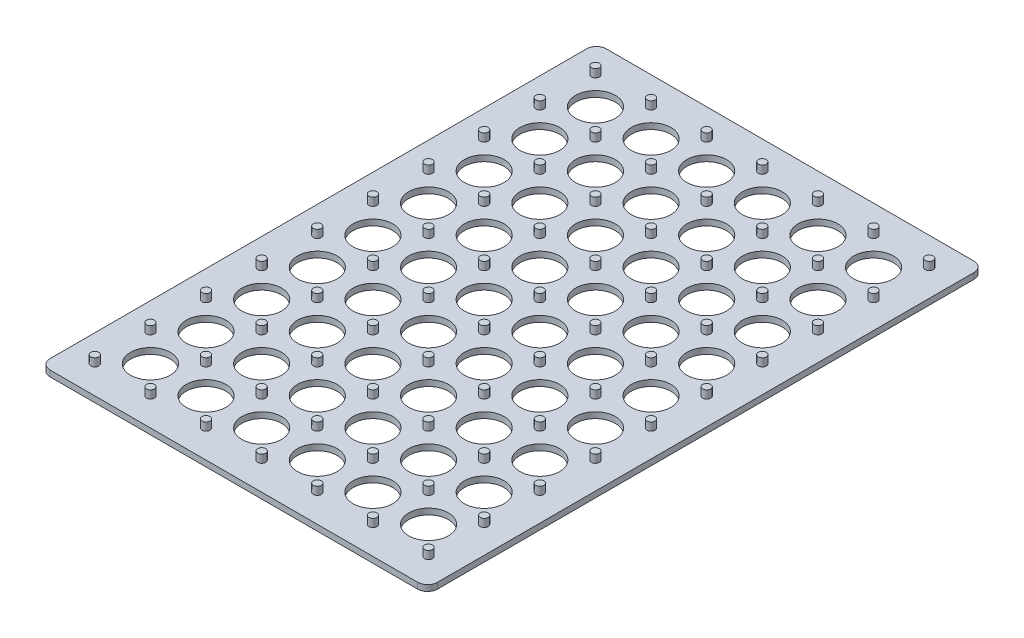
from build123d import *

# Parameters (mm, degrees)
SKETCH_1_W                        = 195
SKETCH_1_H                        = 280
EXTRUDE_1_DEPTH                   = 3
SKETCH_3_R                        = 2
EXTRUDE_2_DEPTH                   = 4
PATTERN_LINEAR_1_COUNT            = 4
PATTERN_LINEAR_1_PITCH            = 28
PATTERN_LINEAR_1_COL_COUNT        = 4
PATTERN_LINEAR_1_COL_PITCH        = 28
PATTERN_LINEAR_2_COUNT            = 10
PATTERN_LINEAR_2_PITCH            = 28
PATTERN_LINEAR_2_COPY_1_SKETCH_R  = 2
PATTERN_LINEAR_2_COPY_1_DEPTH     = 4
PATTERN_LINEAR_2_COPY_2_SKETCH_R  = 2
PATTERN_LINEAR_2_COPY_2_DEPTH     = 4
PATTERN_LINEAR_2_COPY_3_SKETCH_R  = 2
PATTERN_LINEAR_2_COPY_3_DEPTH     = 4
PATTERN_LINEAR_2_COPY_4_SKETCH_R  = 2
PATTERN_LINEAR_2_COPY_4_DEPTH     = 4
PATTERN_LINEAR_2_COPY_5_SKETCH_R  = 2
PATTERN_LINEAR_2_COPY_5_DEPTH     = 4
PATTERN_LINEAR_2_COPY_6_SKETCH_R  = 2
PATTERN_LINEAR_2_COPY_6_DEPTH     = 4
PATTERN_LINEAR_2_COPY_7_SKETCH_R  = 2
PATTERN_LINEAR_2_COPY_7_DEPTH     = 4
PATTERN_LINEAR_2_COPY_8_SKETCH_R  = 2
PATTERN_LINEAR_2_COPY_8_DEPTH     = 4
PATTERN_LINEAR_2_COPY_9_SKETCH_R  = 2
PATTERN_LINEAR_2_COPY_9_DEPTH     = 4
PATTERN_LINEAR_2_COPY_10_SKETCH_R = 2
PATTERN_LINEAR_2_COPY_10_DEPTH    = 4
PATTERN_LINEAR_2_COPY_11_SKETCH_R = 2
PATTERN_LINEAR_2_COPY_11_DEPTH    = 4
PATTERN_LINEAR_2_COPY_12_SKETCH_R = 2
PATTERN_LINEAR_2_COPY_12_DEPTH    = 4
PATTERN_LINEAR_2_COPY_13_SKETCH_R = 2
PATTERN_LINEAR_2_COPY_13_DEPTH    = 4
PATTERN_LINEAR_2_COPY_14_SKETCH_R = 2
PATTERN_LINEAR_2_COPY_14_DEPTH    = 4
PATTERN_LINEAR_2_COPY_15_SKETCH_R = 2
PATTERN_LINEAR_2_COPY_15_DEPTH    = 4
PATTERN_LINEAR_2_COPY_16_SKETCH_R = 2
PATTERN_LINEAR_2_COPY_16_DEPTH    = 4
PATTERN_LINEAR_2_COPY_17_SKETCH_R = 2
PATTERN_LINEAR_2_COPY_17_DEPTH    = 4
PATTERN_LINEAR_2_COPY_18_SKETCH_R = 2
PATTERN_LINEAR_2_COPY_18_DEPTH    = 4
PATTERN_LINEAR_2_COPY_19_SKETCH_R = 2
PATTERN_LINEAR_2_COPY_19_DEPTH    = 4
PATTERN_LINEAR_2_COPY_20_SKETCH_R = 2
PATTERN_LINEAR_2_COPY_20_DEPTH    = 4
PATTERN_LINEAR_2_COPY_21_SKETCH_R = 2
PATTERN_LINEAR_2_COPY_21_DEPTH    = 4
PATTERN_LINEAR_2_COPY_22_SKETCH_R = 2
PATTERN_LINEAR_2_COPY_22_DEPTH    = 4
PATTERN_LINEAR_2_COPY_23_SKETCH_R = 2
PATTERN_LINEAR_2_COPY_23_DEPTH    = 4
PATTERN_LINEAR_2_COPY_24_SKETCH_R = 2
PATTERN_LINEAR_2_COPY_24_DEPTH    = 4
PATTERN_LINEAR_2_COPY_25_SKETCH_R = 2
PATTERN_LINEAR_2_COPY_25_DEPTH    = 4
PATTERN_LINEAR_2_COPY_26_SKETCH_R = 2
PATTERN_LINEAR_2_COPY_26_DEPTH    = 4
PATTERN_LINEAR_2_COPY_27_SKETCH_R = 2
PATTERN_LINEAR_2_COPY_27_DEPTH    = 4
PATTERN_LINEAR_2_COPY_28_SKETCH_R = 2
PATTERN_LINEAR_2_COPY_28_DEPTH    = 4
PATTERN_LINEAR_2_COPY_29_SKETCH_R = 2
PATTERN_LINEAR_2_COPY_29_DEPTH    = 4
PATTERN_LINEAR_2_COPY_30_SKETCH_R = 2
PATTERN_LINEAR_2_COPY_30_DEPTH    = 4
PATTERN_LINEAR_2_COPY_31_SKETCH_R = 2
PATTERN_LINEAR_2_COPY_31_DEPTH    = 4
PATTERN_LINEAR_2_COPY_32_SKETCH_R = 2
PATTERN_LINEAR_2_COPY_32_DEPTH    = 4
PATTERN_LINEAR_2_COPY_33_SKETCH_R = 2
PATTERN_LINEAR_2_COPY_33_DEPTH    = 4
PATTERN_LINEAR_2_COPY_34_SKETCH_R = 2
PATTERN_LINEAR_2_COPY_34_DEPTH    = 4
PATTERN_LINEAR_2_COPY_35_SKETCH_R = 2
PATTERN_LINEAR_2_COPY_35_DEPTH    = 4
PATTERN_LINEAR_2_COPY_36_SKETCH_R = 2
PATTERN_LINEAR_2_COPY_36_DEPTH    = 4
PATTERN_LINEAR_2_COPY_37_SKETCH_R = 2
PATTERN_LINEAR_2_COPY_37_DEPTH    = 4
PATTERN_LINEAR_2_COPY_38_SKETCH_R = 2
PATTERN_LINEAR_2_COPY_38_DEPTH    = 4
PATTERN_LINEAR_2_COPY_39_SKETCH_R = 2
PATTERN_LINEAR_2_COPY_39_DEPTH    = 4
PATTERN_LINEAR_2_COPY_40_SKETCH_R = 2
PATTERN_LINEAR_2_COPY_40_DEPTH    = 4
PATTERN_LINEAR_2_COPY_41_SKETCH_R = 2
PATTERN_LINEAR_2_COPY_41_DEPTH    = 4
PATTERN_LINEAR_2_COPY_42_SKETCH_R = 2
PATTERN_LINEAR_2_COPY_42_DEPTH    = 4
PATTERN_LINEAR_2_COPY_43_SKETCH_R = 2
PATTERN_LINEAR_2_COPY_43_DEPTH    = 4
PATTERN_LINEAR_2_COPY_44_SKETCH_R = 2
PATTERN_LINEAR_2_COPY_44_DEPTH    = 4
PATTERN_LINEAR_2_COPY_45_SKETCH_R = 2
PATTERN_LINEAR_2_COPY_45_DEPTH    = 4
PATTERN_LINEAR_2_COPY_46_SKETCH_R = 2
PATTERN_LINEAR_2_COPY_46_DEPTH    = 4
PATTERN_LINEAR_2_COPY_47_SKETCH_R = 2
PATTERN_LINEAR_2_COPY_47_DEPTH    = 4
PATTERN_LINEAR_2_COPY_48_SKETCH_R = 2
PATTERN_LINEAR_2_COPY_48_DEPTH    = 4
PATTERN_LINEAR_2_COPY_49_SKETCH_R = 2
PATTERN_LINEAR_2_COPY_49_DEPTH    = 4
PATTERN_LINEAR_2_COPY_50_SKETCH_R = 2
PATTERN_LINEAR_2_COPY_50_DEPTH    = 4
PATTERN_LINEAR_2_COPY_51_SKETCH_R = 2
PATTERN_LINEAR_2_COPY_51_DEPTH    = 4
PATTERN_LINEAR_2_COPY_52_SKETCH_R = 2
PATTERN_LINEAR_2_COPY_52_DEPTH    = 4
PATTERN_LINEAR_2_COPY_53_SKETCH_R = 2
PATTERN_LINEAR_2_COPY_53_DEPTH    = 4
PATTERN_LINEAR_2_COPY_54_SKETCH_R = 2
PATTERN_LINEAR_2_COPY_54_DEPTH    = 4
SKETCH_4_R                        = 10
CUT_EXTRUDE_1_DEPTH               = 3
PATTERN_LINEAR_3_COUNT            = 3
PATTERN_LINEAR_3_PITCH            = 28
PATTERN_LINEAR_3_COL_COUNT        = 4
PATTERN_LINEAR_3_COL_PITCH        = 28
PATTERN_LINEAR_4_COUNT            = 9
PATTERN_LINEAR_4_PITCH            = 28
PATTERN_LINEAR_4_COPY_1_SKETCH_R  = 10
PATTERN_LINEAR_4_COPY_1_DEPTH     = 3
PATTERN_LINEAR_4_COPY_2_SKETCH_R  = 10
PATTERN_LINEAR_4_COPY_2_DEPTH     = 3
PATTERN_LINEAR_4_COPY_3_SKETCH_R  = 10
PATTERN_LINEAR_4_COPY_3_DEPTH     = 3
PATTERN_LINEAR_4_COPY_4_SKETCH_R  = 10
PATTERN_LINEAR_4_COPY_4_DEPTH     = 3
PATTERN_LINEAR_4_COPY_5_SKETCH_R  = 10
PATTERN_LINEAR_4_COPY_5_DEPTH     = 3
PATTERN_LINEAR_4_COPY_6_SKETCH_R  = 10
PATTERN_LINEAR_4_COPY_6_DEPTH     = 3
PATTERN_LINEAR_4_COPY_7_SKETCH_R  = 10
PATTERN_LINEAR_4_COPY_7_DEPTH     = 3
PATTERN_LINEAR_4_COPY_8_SKETCH_R  = 10
PATTERN_LINEAR_4_COPY_8_DEPTH     = 3
PATTERN_LINEAR_4_COPY_9_SKETCH_R  = 10
PATTERN_LINEAR_4_COPY_9_DEPTH     = 3
PATTERN_LINEAR_4_COPY_10_SKETCH_R = 10
PATTERN_LINEAR_4_COPY_10_DEPTH    = 3
PATTERN_LINEAR_4_COPY_11_SKETCH_R = 10
PATTERN_LINEAR_4_COPY_11_DEPTH    = 3
PATTERN_LINEAR_4_COPY_12_SKETCH_R = 10
PATTERN_LINEAR_4_COPY_12_DEPTH    = 3
PATTERN_LINEAR_4_COPY_13_SKETCH_R = 10
PATTERN_LINEAR_4_COPY_13_DEPTH    = 3
PATTERN_LINEAR_4_COPY_14_SKETCH_R = 10
PATTERN_LINEAR_4_COPY_14_DEPTH    = 3
PATTERN_LINEAR_4_COPY_15_SKETCH_R = 10
PATTERN_LINEAR_4_COPY_15_DEPTH    = 3
PATTERN_LINEAR_4_COPY_16_SKETCH_R = 10
PATTERN_LINEAR_4_COPY_16_DEPTH    = 3
PATTERN_LINEAR_4_COPY_17_SKETCH_R = 10
PATTERN_LINEAR_4_COPY_17_DEPTH    = 3
PATTERN_LINEAR_4_COPY_18_SKETCH_R = 10
PATTERN_LINEAR_4_COPY_18_DEPTH    = 3
PATTERN_LINEAR_4_COPY_19_SKETCH_R = 10
PATTERN_LINEAR_4_COPY_19_DEPTH    = 3
PATTERN_LINEAR_4_COPY_20_SKETCH_R = 10
PATTERN_LINEAR_4_COPY_20_DEPTH    = 3
PATTERN_LINEAR_4_COPY_21_SKETCH_R = 10
PATTERN_LINEAR_4_COPY_21_DEPTH    = 3
PATTERN_LINEAR_4_COPY_22_SKETCH_R = 10
PATTERN_LINEAR_4_COPY_22_DEPTH    = 3
PATTERN_LINEAR_4_COPY_23_SKETCH_R = 10
PATTERN_LINEAR_4_COPY_23_DEPTH    = 3
PATTERN_LINEAR_4_COPY_24_SKETCH_R = 10
PATTERN_LINEAR_4_COPY_24_DEPTH    = 3
PATTERN_LINEAR_4_COPY_25_SKETCH_R = 10
PATTERN_LINEAR_4_COPY_25_DEPTH    = 3
PATTERN_LINEAR_4_COPY_26_SKETCH_R = 10
PATTERN_LINEAR_4_COPY_26_DEPTH    = 3
PATTERN_LINEAR_4_COPY_27_SKETCH_R = 10
PATTERN_LINEAR_4_COPY_27_DEPTH    = 3
PATTERN_LINEAR_4_COPY_28_SKETCH_R = 10
PATTERN_LINEAR_4_COPY_28_DEPTH    = 3
PATTERN_LINEAR_4_COPY_29_SKETCH_R = 10
PATTERN_LINEAR_4_COPY_29_DEPTH    = 3
PATTERN_LINEAR_4_COPY_30_SKETCH_R = 10
PATTERN_LINEAR_4_COPY_30_DEPTH    = 3
PATTERN_LINEAR_4_COPY_31_SKETCH_R = 10
PATTERN_LINEAR_4_COPY_31_DEPTH    = 3
PATTERN_LINEAR_4_COPY_32_SKETCH_R = 10
PATTERN_LINEAR_4_COPY_32_DEPTH    = 3
PATTERN_LINEAR_4_COPY_33_SKETCH_R = 10
PATTERN_LINEAR_4_COPY_33_DEPTH    = 3
PATTERN_LINEAR_4_COPY_34_SKETCH_R = 10
PATTERN_LINEAR_4_COPY_34_DEPTH    = 3
PATTERN_LINEAR_4_COPY_35_SKETCH_R = 10
PATTERN_LINEAR_4_COPY_35_DEPTH    = 3
PATTERN_LINEAR_4_COPY_36_SKETCH_R = 10
PATTERN_LINEAR_4_COPY_36_DEPTH    = 3
PATTERN_LINEAR_4_COPY_37_SKETCH_R = 10
PATTERN_LINEAR_4_COPY_37_DEPTH    = 3
PATTERN_LINEAR_4_COPY_38_SKETCH_R = 10
PATTERN_LINEAR_4_COPY_38_DEPTH    = 3
PATTERN_LINEAR_4_COPY_39_SKETCH_R = 10
PATTERN_LINEAR_4_COPY_39_DEPTH    = 3
PATTERN_LINEAR_4_COPY_40_SKETCH_R = 10
PATTERN_LINEAR_4_COPY_40_DEPTH    = 3
FILLET_1_R                        = 5


with BuildPart() as part:
    # Эскиз1 → Бобышка-Вытянуть1 (new body)
    with BuildSketch(Plane(origin=(0, 0, 0), x_dir=(1, 0, 0), z_dir=(0, 1, 0))):
        with Locations((97.5, 140)):
            Rectangle(SKETCH_1_W, SKETCH_1_H)
    extrude(amount=EXTRUDE_1_DEPTH)

    # Эскиз3 → Бобышка-Вытянуть2 (add)
    with BuildSketch(Plane(origin=(0, 3, 0), x_dir=(1, 0, 0), z_dir=(0, 1, 0))):
        with Locations(Location((97.5, 266, 0), (0, 0, 90))):
            Circle(SKETCH_3_R)
    extrude_2 = extrude(amount=EXTRUDE_2_DEPTH)

    # Линейный массив1: Бобышка-Вытянуть2 ×4
    with Locations(*[(i * PATTERN_LINEAR_1_PITCH, 0, 0) for i in range(1, PATTERN_LINEAR_1_COUNT)]):
        add(extrude_2)

    # Линейный массив1 col: Бобышка-Вытянуть2 ×4
    with Locations(*[(-i * PATTERN_LINEAR_1_COL_PITCH, 0, 0) for i in range(1, PATTERN_LINEAR_1_COL_COUNT)]):
        add(extrude_2)

    # Линейный массив2: Бобышка-Вытянуть2 ×10
    with Locations(*[(0, 0, i * PATTERN_LINEAR_2_PITCH) for i in range(1, PATTERN_LINEAR_2_COUNT)]):
        add(extrude_2)

    # Линейный массив2 copy 1 sketch → Линейный массив2 copy 1 (add)
    with BuildSketch(Plane(origin=(28, 3, 28), x_dir=(1, 0, 0), z_dir=(0, 1, 0))):
        with Locations(Location((97.5, 266, 0), (0, 0, 90))):
            Circle(PATTERN_LINEAR_2_COPY_1_SKETCH_R)
    extrude(amount=PATTERN_LINEAR_2_COPY_1_DEPTH)

    # Линейный массив2 copy 2 sketch → Линейный массив2 copy 2 (add)
    with BuildSketch(Plane(origin=(28, 3, 56), x_dir=(1, 0, 0), z_dir=(0, 1, 0))):
        with Locations(Location((97.5, 266, 0), (0, 0, 90))):
            Circle(PATTERN_LINEAR_2_COPY_2_SKETCH_R)
    extrude(amount=PATTERN_LINEAR_2_COPY_2_DEPTH)

    # Линейный массив2 copy 3 sketch → Линейный массив2 copy 3 (add)
    with BuildSketch(Plane(origin=(28, 3, 84), x_dir=(1, 0, 0), z_dir=(0, 1, 0))):
        with Locations(Location((97.5, 266, 0), (0, 0, 90))):
            Circle(PATTERN_LINEAR_2_COPY_3_SKETCH_R)
    extrude(amount=PATTERN_LINEAR_2_COPY_3_DEPTH)

    # Линейный массив2 copy 4 sketch → Линейный массив2 copy 4 (add)
    with BuildSketch(Plane(origin=(28, 3, 112), x_dir=(1, 0, 0), z_dir=(0, 1, 0))):
        with Locations(Location((97.5, 266, 0), (0, 0, 90))):
            Circle(PATTERN_LINEAR_2_COPY_4_SKETCH_R)
    extrude(amount=PATTERN_LINEAR_2_COPY_4_DEPTH)

    # Линейный массив2 copy 5 sketch → Линейный массив2 copy 5 (add)
    with BuildSketch(Plane(origin=(28, 3, 140), x_dir=(1, 0, 0), z_dir=(0, 1, 0))):
        with Locations(Location((97.5, 266, 0), (0, 0, 90))):
            Circle(PATTERN_LINEAR_2_COPY_5_SKETCH_R)
    extrude(amount=PATTERN_LINEAR_2_COPY_5_DEPTH)

    # Линейный массив2 copy 6 sketch → Линейный массив2 copy 6 (add)
    with BuildSketch(Plane(origin=(28, 3, 168), x_dir=(1, 0, 0), z_dir=(0, 1, 0))):
        with Locations(Location((97.5, 266, 0), (0, 0, 90))):
            Circle(PATTERN_LINEAR_2_COPY_6_SKETCH_R)
    extrude(amount=PATTERN_LINEAR_2_COPY_6_DEPTH)

    # Линейный массив2 copy 7 sketch → Линейный массив2 copy 7 (add)
    with BuildSketch(Plane(origin=(28, 3, 196), x_dir=(1, 0, 0), z_dir=(0, 1, 0))):
        with Locations(Location((97.5, 266, 0), (0, 0, 90))):
            Circle(PATTERN_LINEAR_2_COPY_7_SKETCH_R)
    extrude(amount=PATTERN_LINEAR_2_COPY_7_DEPTH)

    # Линейный массив2 copy 8 sketch → Линейный массив2 copy 8 (add)
    with BuildSketch(Plane(origin=(28, 3, 224), x_dir=(1, 0, 0), z_dir=(0, 1, 0))):
        with Locations(Location((97.5, 266, 0), (0, 0, 90))):
            Circle(PATTERN_LINEAR_2_COPY_8_SKETCH_R)
    extrude(amount=PATTERN_LINEAR_2_COPY_8_DEPTH)

    # Линейный массив2 copy 9 sketch → Линейный массив2 copy 9 (add)
    with BuildSketch(Plane(origin=(28, 3, 252), x_dir=(1, 0, 0), z_dir=(0, 1, 0))):
        with Locations(Location((97.5, 266, 0), (0, 0, 90))):
            Circle(PATTERN_LINEAR_2_COPY_9_SKETCH_R)
    extrude(amount=PATTERN_LINEAR_2_COPY_9_DEPTH)

    # Линейный массив2 copy 10 sketch → Линейный массив2 copy 10 (add)
    with BuildSketch(Plane(origin=(56, 3, 28), x_dir=(1, 0, 0), z_dir=(0, 1, 0))):
        with Locations(Location((97.5, 266, 0), (0, 0, 90))):
            Circle(PATTERN_LINEAR_2_COPY_10_SKETCH_R)
    extrude(amount=PATTERN_LINEAR_2_COPY_10_DEPTH)

    # Линейный массив2 copy 11 sketch → Линейный массив2 copy 11 (add)
    with BuildSketch(Plane(origin=(56, 3, 56), x_dir=(1, 0, 0), z_dir=(0, 1, 0))):
        with Locations(Location((97.5, 266, 0), (0, 0, 90))):
            Circle(PATTERN_LINEAR_2_COPY_11_SKETCH_R)
    extrude(amount=PATTERN_LINEAR_2_COPY_11_DEPTH)

    # Линейный массив2 copy 12 sketch → Линейный массив2 copy 12 (add)
    with BuildSketch(Plane(origin=(56, 3, 84), x_dir=(1, 0, 0), z_dir=(0, 1, 0))):
        with Locations(Location((97.5, 266, 0), (0, 0, 90))):
            Circle(PATTERN_LINEAR_2_COPY_12_SKETCH_R)
    extrude(amount=PATTERN_LINEAR_2_COPY_12_DEPTH)

    # Линейный массив2 copy 13 sketch → Линейный массив2 copy 13 (add)
    with BuildSketch(Plane(origin=(56, 3, 112), x_dir=(1, 0, 0), z_dir=(0, 1, 0))):
        with Locations(Location((97.5, 266, 0), (0, 0, 90))):
            Circle(PATTERN_LINEAR_2_COPY_13_SKETCH_R)
    extrude(amount=PATTERN_LINEAR_2_COPY_13_DEPTH)

    # Линейный массив2 copy 14 sketch → Линейный массив2 copy 14 (add)
    with BuildSketch(Plane(origin=(56, 3, 140), x_dir=(1, 0, 0), z_dir=(0, 1, 0))):
        with Locations(Location((97.5, 266, 0), (0, 0, 90))):
            Circle(PATTERN_LINEAR_2_COPY_14_SKETCH_R)
    extrude(amount=PATTERN_LINEAR_2_COPY_14_DEPTH)

    # Линейный массив2 copy 15 sketch → Линейный массив2 copy 15 (add)
    with BuildSketch(Plane(origin=(56, 3, 168), x_dir=(1, 0, 0), z_dir=(0, 1, 0))):
        with Locations(Location((97.5, 266, 0), (0, 0, 90))):
            Circle(PATTERN_LINEAR_2_COPY_15_SKETCH_R)
    extrude(amount=PATTERN_LINEAR_2_COPY_15_DEPTH)

    # Линейный массив2 copy 16 sketch → Линейный массив2 copy 16 (add)
    with BuildSketch(Plane(origin=(56, 3, 196), x_dir=(1, 0, 0), z_dir=(0, 1, 0))):
        with Locations(Location((97.5, 266, 0), (0, 0, 90))):
            Circle(PATTERN_LINEAR_2_COPY_16_SKETCH_R)
    extrude(amount=PATTERN_LINEAR_2_COPY_16_DEPTH)

    # Линейный массив2 copy 17 sketch → Линейный массив2 copy 17 (add)
    with BuildSketch(Plane(origin=(56, 3, 224), x_dir=(1, 0, 0), z_dir=(0, 1, 0))):
        with Locations(Location((97.5, 266, 0), (0, 0, 90))):
            Circle(PATTERN_LINEAR_2_COPY_17_SKETCH_R)
    extrude(amount=PATTERN_LINEAR_2_COPY_17_DEPTH)

    # Линейный массив2 copy 18 sketch → Линейный массив2 copy 18 (add)
    with BuildSketch(Plane(origin=(56, 3, 252), x_dir=(1, 0, 0), z_dir=(0, 1, 0))):
        with Locations(Location((97.5, 266, 0), (0, 0, 90))):
            Circle(PATTERN_LINEAR_2_COPY_18_SKETCH_R)
    extrude(amount=PATTERN_LINEAR_2_COPY_18_DEPTH)

    # Линейный массив2 copy 19 sketch → Линейный массив2 copy 19 (add)
    with BuildSketch(Plane(origin=(84, 3, 28), x_dir=(1, 0, 0), z_dir=(0, 1, 0))):
        with Locations(Location((97.5, 266, 0), (0, 0, 90))):
            Circle(PATTERN_LINEAR_2_COPY_19_SKETCH_R)
    extrude(amount=PATTERN_LINEAR_2_COPY_19_DEPTH)

    # Линейный массив2 copy 20 sketch → Линейный массив2 copy 20 (add)
    with BuildSketch(Plane(origin=(84, 3, 56), x_dir=(1, 0, 0), z_dir=(0, 1, 0))):
        with Locations(Location((97.5, 266, 0), (0, 0, 90))):
            Circle(PATTERN_LINEAR_2_COPY_20_SKETCH_R)
    extrude(amount=PATTERN_LINEAR_2_COPY_20_DEPTH)

    # Линейный массив2 copy 21 sketch → Линейный массив2 copy 21 (add)
    with BuildSketch(Plane(origin=(84, 3, 84), x_dir=(1, 0, 0), z_dir=(0, 1, 0))):
        with Locations(Location((97.5, 266, 0), (0, 0, 90))):
            Circle(PATTERN_LINEAR_2_COPY_21_SKETCH_R)
    extrude(amount=PATTERN_LINEAR_2_COPY_21_DEPTH)

    # Линейный массив2 copy 22 sketch → Линейный массив2 copy 22 (add)
    with BuildSketch(Plane(origin=(84, 3, 112), x_dir=(1, 0, 0), z_dir=(0, 1, 0))):
        with Locations(Location((97.5, 266, 0), (0, 0, 90))):
            Circle(PATTERN_LINEAR_2_COPY_22_SKETCH_R)
    extrude(amount=PATTERN_LINEAR_2_COPY_22_DEPTH)

    # Линейный массив2 copy 23 sketch → Линейный массив2 copy 23 (add)
    with BuildSketch(Plane(origin=(84, 3, 140), x_dir=(1, 0, 0), z_dir=(0, 1, 0))):
        with Locations(Location((97.5, 266, 0), (0, 0, 90))):
            Circle(PATTERN_LINEAR_2_COPY_23_SKETCH_R)
    extrude(amount=PATTERN_LINEAR_2_COPY_23_DEPTH)

    # Линейный массив2 copy 24 sketch → Линейный массив2 copy 24 (add)
    with BuildSketch(Plane(origin=(84, 3, 168), x_dir=(1, 0, 0), z_dir=(0, 1, 0))):
        with Locations(Location((97.5, 266, 0), (0, 0, 90))):
            Circle(PATTERN_LINEAR_2_COPY_24_SKETCH_R)
    extrude(amount=PATTERN_LINEAR_2_COPY_24_DEPTH)

    # Линейный массив2 copy 25 sketch → Линейный массив2 copy 25 (add)
    with BuildSketch(Plane(origin=(84, 3, 196), x_dir=(1, 0, 0), z_dir=(0, 1, 0))):
        with Locations(Location((97.5, 266, 0), (0, 0, 90))):
            Circle(PATTERN_LINEAR_2_COPY_25_SKETCH_R)
    extrude(amount=PATTERN_LINEAR_2_COPY_25_DEPTH)

    # Линейный массив2 copy 26 sketch → Линейный массив2 copy 26 (add)
    with BuildSketch(Plane(origin=(84, 3, 224), x_dir=(1, 0, 0), z_dir=(0, 1, 0))):
        with Locations(Location((97.5, 266, 0), (0, 0, 90))):
            Circle(PATTERN_LINEAR_2_COPY_26_SKETCH_R)
    extrude(amount=PATTERN_LINEAR_2_COPY_26_DEPTH)

    # Линейный массив2 copy 27 sketch → Линейный массив2 copy 27 (add)
    with BuildSketch(Plane(origin=(84, 3, 252), x_dir=(1, 0, 0), z_dir=(0, 1, 0))):
        with Locations(Location((97.5, 266, 0), (0, 0, 90))):
            Circle(PATTERN_LINEAR_2_COPY_27_SKETCH_R)
    extrude(amount=PATTERN_LINEAR_2_COPY_27_DEPTH)

    # Линейный массив2 copy 28 sketch → Линейный массив2 copy 28 (add)
    with BuildSketch(Plane(origin=(-28, 3, 28), x_dir=(1, 0, 0), z_dir=(0, 1, 0))):
        with Locations(Location((97.5, 266, 0), (0, 0, 90))):
            Circle(PATTERN_LINEAR_2_COPY_28_SKETCH_R)
    extrude(amount=PATTERN_LINEAR_2_COPY_28_DEPTH)

    # Линейный массив2 copy 29 sketch → Линейный массив2 copy 29 (add)
    with BuildSketch(Plane(origin=(-28, 3, 56), x_dir=(1, 0, 0), z_dir=(0, 1, 0))):
        with Locations(Location((97.5, 266, 0), (0, 0, 90))):
            Circle(PATTERN_LINEAR_2_COPY_29_SKETCH_R)
    extrude(amount=PATTERN_LINEAR_2_COPY_29_DEPTH)

    # Линейный массив2 copy 30 sketch → Линейный массив2 copy 30 (add)
    with BuildSketch(Plane(origin=(-28, 3, 84), x_dir=(1, 0, 0), z_dir=(0, 1, 0))):
        with Locations(Location((97.5, 266, 0), (0, 0, 90))):
            Circle(PATTERN_LINEAR_2_COPY_30_SKETCH_R)
    extrude(amount=PATTERN_LINEAR_2_COPY_30_DEPTH)

    # Линейный массив2 copy 31 sketch → Линейный массив2 copy 31 (add)
    with BuildSketch(Plane(origin=(-28, 3, 112), x_dir=(1, 0, 0), z_dir=(0, 1, 0))):
        with Locations(Location((97.5, 266, 0), (0, 0, 90))):
            Circle(PATTERN_LINEAR_2_COPY_31_SKETCH_R)
    extrude(amount=PATTERN_LINEAR_2_COPY_31_DEPTH)

    # Линейный массив2 copy 32 sketch → Линейный массив2 copy 32 (add)
    with BuildSketch(Plane(origin=(-28, 3, 140), x_dir=(1, 0, 0), z_dir=(0, 1, 0))):
        with Locations(Location((97.5, 266, 0), (0, 0, 90))):
            Circle(PATTERN_LINEAR_2_COPY_32_SKETCH_R)
    extrude(amount=PATTERN_LINEAR_2_COPY_32_DEPTH)

    # Линейный массив2 copy 33 sketch → Линейный массив2 copy 33 (add)
    with BuildSketch(Plane(origin=(-28, 3, 168), x_dir=(1, 0, 0), z_dir=(0, 1, 0))):
        with Locations(Location((97.5, 266, 0), (0, 0, 90))):
            Circle(PATTERN_LINEAR_2_COPY_33_SKETCH_R)
    extrude(amount=PATTERN_LINEAR_2_COPY_33_DEPTH)

    # Линейный массив2 copy 34 sketch → Линейный массив2 copy 34 (add)
    with BuildSketch(Plane(origin=(-28, 3, 196), x_dir=(1, 0, 0), z_dir=(0, 1, 0))):
        with Locations(Location((97.5, 266, 0), (0, 0, 90))):
            Circle(PATTERN_LINEAR_2_COPY_34_SKETCH_R)
    extrude(amount=PATTERN_LINEAR_2_COPY_34_DEPTH)

    # Линейный массив2 copy 35 sketch → Линейный массив2 copy 35 (add)
    with BuildSketch(Plane(origin=(-28, 3, 224), x_dir=(1, 0, 0), z_dir=(0, 1, 0))):
        with Locations(Location((97.5, 266, 0), (0, 0, 90))):
            Circle(PATTERN_LINEAR_2_COPY_35_SKETCH_R)
    extrude(amount=PATTERN_LINEAR_2_COPY_35_DEPTH)

    # Линейный массив2 copy 36 sketch → Линейный массив2 copy 36 (add)
    with BuildSketch(Plane(origin=(-28, 3, 252), x_dir=(1, 0, 0), z_dir=(0, 1, 0))):
        with Locations(Location((97.5, 266, 0), (0, 0, 90))):
            Circle(PATTERN_LINEAR_2_COPY_36_SKETCH_R)
    extrude(amount=PATTERN_LINEAR_2_COPY_36_DEPTH)

    # Линейный массив2 copy 37 sketch → Линейный массив2 copy 37 (add)
    with BuildSketch(Plane(origin=(-56, 3, 28), x_dir=(1, 0, 0), z_dir=(0, 1, 0))):
        with Locations(Location((97.5, 266, 0), (0, 0, 90))):
            Circle(PATTERN_LINEAR_2_COPY_37_SKETCH_R)
    extrude(amount=PATTERN_LINEAR_2_COPY_37_DEPTH)

    # Линейный массив2 copy 38 sketch → Линейный массив2 copy 38 (add)
    with BuildSketch(Plane(origin=(-56, 3, 56), x_dir=(1, 0, 0), z_dir=(0, 1, 0))):
        with Locations(Location((97.5, 266, 0), (0, 0, 90))):
            Circle(PATTERN_LINEAR_2_COPY_38_SKETCH_R)
    extrude(amount=PATTERN_LINEAR_2_COPY_38_DEPTH)

    # Линейный массив2 copy 39 sketch → Линейный массив2 copy 39 (add)
    with BuildSketch(Plane(origin=(-56, 3, 84), x_dir=(1, 0, 0), z_dir=(0, 1, 0))):
        with Locations(Location((97.5, 266, 0), (0, 0, 90))):
            Circle(PATTERN_LINEAR_2_COPY_39_SKETCH_R)
    extrude(amount=PATTERN_LINEAR_2_COPY_39_DEPTH)

    # Линейный массив2 copy 40 sketch → Линейный массив2 copy 40 (add)
    with BuildSketch(Plane(origin=(-56, 3, 112), x_dir=(1, 0, 0), z_dir=(0, 1, 0))):
        with Locations(Location((97.5, 266, 0), (0, 0, 90))):
            Circle(PATTERN_LINEAR_2_COPY_40_SKETCH_R)
    extrude(amount=PATTERN_LINEAR_2_COPY_40_DEPTH)

    # Линейный массив2 copy 41 sketch → Линейный массив2 copy 41 (add)
    with BuildSketch(Plane(origin=(-56, 3, 140), x_dir=(1, 0, 0), z_dir=(0, 1, 0))):
        with Locations(Location((97.5, 266, 0), (0, 0, 90))):
            Circle(PATTERN_LINEAR_2_COPY_41_SKETCH_R)
    extrude(amount=PATTERN_LINEAR_2_COPY_41_DEPTH)

    # Линейный массив2 copy 42 sketch → Линейный массив2 copy 42 (add)
    with BuildSketch(Plane(origin=(-56, 3, 168), x_dir=(1, 0, 0), z_dir=(0, 1, 0))):
        with Locations(Location((97.5, 266, 0), (0, 0, 90))):
            Circle(PATTERN_LINEAR_2_COPY_42_SKETCH_R)
    extrude(amount=PATTERN_LINEAR_2_COPY_42_DEPTH)

    # Линейный массив2 copy 43 sketch → Линейный массив2 copy 43 (add)
    with BuildSketch(Plane(origin=(-56, 3, 196), x_dir=(1, 0, 0), z_dir=(0, 1, 0))):
        with Locations(Location((97.5, 266, 0), (0, 0, 90))):
            Circle(PATTERN_LINEAR_2_COPY_43_SKETCH_R)
    extrude(amount=PATTERN_LINEAR_2_COPY_43_DEPTH)

    # Линейный массив2 copy 44 sketch → Линейный массив2 copy 44 (add)
    with BuildSketch(Plane(origin=(-56, 3, 224), x_dir=(1, 0, 0), z_dir=(0, 1, 0))):
        with Locations(Location((97.5, 266, 0), (0, 0, 90))):
            Circle(PATTERN_LINEAR_2_COPY_44_SKETCH_R)
    extrude(amount=PATTERN_LINEAR_2_COPY_44_DEPTH)

    # Линейный массив2 copy 45 sketch → Линейный массив2 copy 45 (add)
    with BuildSketch(Plane(origin=(-56, 3, 252), x_dir=(1, 0, 0), z_dir=(0, 1, 0))):
        with Locations(Location((97.5, 266, 0), (0, 0, 90))):
            Circle(PATTERN_LINEAR_2_COPY_45_SKETCH_R)
    extrude(amount=PATTERN_LINEAR_2_COPY_45_DEPTH)

    # Линейный массив2 copy 46 sketch → Линейный массив2 copy 46 (add)
    with BuildSketch(Plane(origin=(-84, 3, 28), x_dir=(1, 0, 0), z_dir=(0, 1, 0))):
        with Locations(Location((97.5, 266, 0), (0, 0, 90))):
            Circle(PATTERN_LINEAR_2_COPY_46_SKETCH_R)
    extrude(amount=PATTERN_LINEAR_2_COPY_46_DEPTH)

    # Линейный массив2 copy 47 sketch → Линейный массив2 copy 47 (add)
    with BuildSketch(Plane(origin=(-84, 3, 56), x_dir=(1, 0, 0), z_dir=(0, 1, 0))):
        with Locations(Location((97.5, 266, 0), (0, 0, 90))):
            Circle(PATTERN_LINEAR_2_COPY_47_SKETCH_R)
    extrude(amount=PATTERN_LINEAR_2_COPY_47_DEPTH)

    # Линейный массив2 copy 48 sketch → Линейный массив2 copy 48 (add)
    with BuildSketch(Plane(origin=(-84, 3, 84), x_dir=(1, 0, 0), z_dir=(0, 1, 0))):
        with Locations(Location((97.5, 266, 0), (0, 0, 90))):
            Circle(PATTERN_LINEAR_2_COPY_48_SKETCH_R)
    extrude(amount=PATTERN_LINEAR_2_COPY_48_DEPTH)

    # Линейный массив2 copy 49 sketch → Линейный массив2 copy 49 (add)
    with BuildSketch(Plane(origin=(-84, 3, 112), x_dir=(1, 0, 0), z_dir=(0, 1, 0))):
        with Locations(Location((97.5, 266, 0), (0, 0, 90))):
            Circle(PATTERN_LINEAR_2_COPY_49_SKETCH_R)
    extrude(amount=PATTERN_LINEAR_2_COPY_49_DEPTH)

    # Линейный массив2 copy 50 sketch → Линейный массив2 copy 50 (add)
    with BuildSketch(Plane(origin=(-84, 3, 140), x_dir=(1, 0, 0), z_dir=(0, 1, 0))):
        with Locations(Location((97.5, 266, 0), (0, 0, 90))):
            Circle(PATTERN_LINEAR_2_COPY_50_SKETCH_R)
    extrude(amount=PATTERN_LINEAR_2_COPY_50_DEPTH)

    # Линейный массив2 copy 51 sketch → Линейный массив2 copy 51 (add)
    with BuildSketch(Plane(origin=(-84, 3, 168), x_dir=(1, 0, 0), z_dir=(0, 1, 0))):
        with Locations(Location((97.5, 266, 0), (0, 0, 90))):
            Circle(PATTERN_LINEAR_2_COPY_51_SKETCH_R)
    extrude(amount=PATTERN_LINEAR_2_COPY_51_DEPTH)

    # Линейный массив2 copy 52 sketch → Линейный массив2 copy 52 (add)
    with BuildSketch(Plane(origin=(-84, 3, 196), x_dir=(1, 0, 0), z_dir=(0, 1, 0))):
        with Locations(Location((97.5, 266, 0), (0, 0, 90))):
            Circle(PATTERN_LINEAR_2_COPY_52_SKETCH_R)
    extrude(amount=PATTERN_LINEAR_2_COPY_52_DEPTH)

    # Линейный массив2 copy 53 sketch → Линейный массив2 copy 53 (add)
    with BuildSketch(Plane(origin=(-84, 3, 224), x_dir=(1, 0, 0), z_dir=(0, 1, 0))):
        with Locations(Location((97.5, 266, 0), (0, 0, 90))):
            Circle(PATTERN_LINEAR_2_COPY_53_SKETCH_R)
    extrude(amount=PATTERN_LINEAR_2_COPY_53_DEPTH)

    # Линейный массив2 copy 54 sketch → Линейный массив2 copy 54 (add)
    with BuildSketch(Plane(origin=(-84, 3, 252), x_dir=(1, 0, 0), z_dir=(0, 1, 0))):
        with Locations(Location((97.5, 266, 0), (0, 0, 90))):
            Circle(PATTERN_LINEAR_2_COPY_54_SKETCH_R)
    extrude(amount=PATTERN_LINEAR_2_COPY_54_DEPTH)

    # Эскиз4 → Вырез-Вытянуть1 (cut)
    with BuildSketch(Plane(origin=(0, 3, 0), x_dir=(1, 0, 0), z_dir=(0, 1, 0))):
        with Locations(Location((111.5, 252, 0), (0, 0, 270))):
            Circle(SKETCH_4_R)
    cut_extrude_1 = extrude(amount=-CUT_EXTRUDE_1_DEPTH, mode=Mode.SUBTRACT)

    # Линейный массив3: Вырез-Вытянуть1 ×3
    with Locations(*[(i * PATTERN_LINEAR_3_PITCH, 0, 0) for i in range(1, PATTERN_LINEAR_3_COUNT)]):
        add(cut_extrude_1, mode=Mode.SUBTRACT)

    # Линейный массив3 col: Вырез-Вытянуть1 ×4
    with Locations(*[(-i * PATTERN_LINEAR_3_COL_PITCH, 0, 0) for i in range(1, PATTERN_LINEAR_3_COL_COUNT)]):
        add(cut_extrude_1, mode=Mode.SUBTRACT)

    # Линейный массив4: Вырез-Вытянуть1 ×9
    with Locations(*[(0, 0, i * PATTERN_LINEAR_4_PITCH) for i in range(1, PATTERN_LINEAR_4_COUNT)]):
        add(cut_extrude_1, mode=Mode.SUBTRACT)

    # Линейный массив4 copy 1 sketch → Линейный массив4 copy 1 (cut)
    with BuildSketch(Plane(origin=(28, 3, 28), x_dir=(1, 0, 0), z_dir=(0, 1, 0))):
        with Locations(Location((111.5, 252, 0), (0, 0, 270))):
            Circle(PATTERN_LINEAR_4_COPY_1_SKETCH_R)
    extrude(amount=-PATTERN_LINEAR_4_COPY_1_DEPTH, mode=Mode.SUBTRACT)

    # Линейный массив4 copy 2 sketch → Линейный массив4 copy 2 (cut)
    with BuildSketch(Plane(origin=(28, 3, 56), x_dir=(1, 0, 0), z_dir=(0, 1, 0))):
        with Locations(Location((111.5, 252, 0), (0, 0, 270))):
            Circle(PATTERN_LINEAR_4_COPY_2_SKETCH_R)
    extrude(amount=-PATTERN_LINEAR_4_COPY_2_DEPTH, mode=Mode.SUBTRACT)

    # Линейный массив4 copy 3 sketch → Линейный массив4 copy 3 (cut)
    with BuildSketch(Plane(origin=(28, 3, 84), x_dir=(1, 0, 0), z_dir=(0, 1, 0))):
        with Locations(Location((111.5, 252, 0), (0, 0, 270))):
            Circle(PATTERN_LINEAR_4_COPY_3_SKETCH_R)
    extrude(amount=-PATTERN_LINEAR_4_COPY_3_DEPTH, mode=Mode.SUBTRACT)

    # Линейный массив4 copy 4 sketch → Линейный массив4 copy 4 (cut)
    with BuildSketch(Plane(origin=(28, 3, 112), x_dir=(1, 0, 0), z_dir=(0, 1, 0))):
        with Locations(Location((111.5, 252, 0), (0, 0, 270))):
            Circle(PATTERN_LINEAR_4_COPY_4_SKETCH_R)
    extrude(amount=-PATTERN_LINEAR_4_COPY_4_DEPTH, mode=Mode.SUBTRACT)

    # Линейный массив4 copy 5 sketch → Линейный массив4 copy 5 (cut)
    with BuildSketch(Plane(origin=(28, 3, 140), x_dir=(1, 0, 0), z_dir=(0, 1, 0))):
        with Locations(Location((111.5, 252, 0), (0, 0, 270))):
            Circle(PATTERN_LINEAR_4_COPY_5_SKETCH_R)
    extrude(amount=-PATTERN_LINEAR_4_COPY_5_DEPTH, mode=Mode.SUBTRACT)

    # Линейный массив4 copy 6 sketch → Линейный массив4 copy 6 (cut)
    with BuildSketch(Plane(origin=(28, 3, 168), x_dir=(1, 0, 0), z_dir=(0, 1, 0))):
        with Locations(Location((111.5, 252, 0), (0, 0, 270))):
            Circle(PATTERN_LINEAR_4_COPY_6_SKETCH_R)
    extrude(amount=-PATTERN_LINEAR_4_COPY_6_DEPTH, mode=Mode.SUBTRACT)

    # Линейный массив4 copy 7 sketch → Линейный массив4 copy 7 (cut)
    with BuildSketch(Plane(origin=(28, 3, 196), x_dir=(1, 0, 0), z_dir=(0, 1, 0))):
        with Locations(Location((111.5, 252, 0), (0, 0, 270))):
            Circle(PATTERN_LINEAR_4_COPY_7_SKETCH_R)
    extrude(amount=-PATTERN_LINEAR_4_COPY_7_DEPTH, mode=Mode.SUBTRACT)

    # Линейный массив4 copy 8 sketch → Линейный массив4 copy 8 (cut)
    with BuildSketch(Plane(origin=(28, 3, 224), x_dir=(1, 0, 0), z_dir=(0, 1, 0))):
        with Locations(Location((111.5, 252, 0), (0, 0, 270))):
            Circle(PATTERN_LINEAR_4_COPY_8_SKETCH_R)
    extrude(amount=-PATTERN_LINEAR_4_COPY_8_DEPTH, mode=Mode.SUBTRACT)

    # Линейный массив4 copy 9 sketch → Линейный массив4 copy 9 (cut)
    with BuildSketch(Plane(origin=(56, 3, 28), x_dir=(1, 0, 0), z_dir=(0, 1, 0))):
        with Locations(Location((111.5, 252, 0), (0, 0, 270))):
            Circle(PATTERN_LINEAR_4_COPY_9_SKETCH_R)
    extrude(amount=-PATTERN_LINEAR_4_COPY_9_DEPTH, mode=Mode.SUBTRACT)

    # Линейный массив4 copy 10 sketch → Линейный массив4 copy 10 (cut)
    with BuildSketch(Plane(origin=(56, 3, 56), x_dir=(1, 0, 0), z_dir=(0, 1, 0))):
        with Locations(Location((111.5, 252, 0), (0, 0, 270))):
            Circle(PATTERN_LINEAR_4_COPY_10_SKETCH_R)
    extrude(amount=-PATTERN_LINEAR_4_COPY_10_DEPTH, mode=Mode.SUBTRACT)

    # Линейный массив4 copy 11 sketch → Линейный массив4 copy 11 (cut)
    with BuildSketch(Plane(origin=(56, 3, 84), x_dir=(1, 0, 0), z_dir=(0, 1, 0))):
        with Locations(Location((111.5, 252, 0), (0, 0, 270))):
            Circle(PATTERN_LINEAR_4_COPY_11_SKETCH_R)
    extrude(amount=-PATTERN_LINEAR_4_COPY_11_DEPTH, mode=Mode.SUBTRACT)

    # Линейный массив4 copy 12 sketch → Линейный массив4 copy 12 (cut)
    with BuildSketch(Plane(origin=(56, 3, 112), x_dir=(1, 0, 0), z_dir=(0, 1, 0))):
        with Locations(Location((111.5, 252, 0), (0, 0, 270))):
            Circle(PATTERN_LINEAR_4_COPY_12_SKETCH_R)
    extrude(amount=-PATTERN_LINEAR_4_COPY_12_DEPTH, mode=Mode.SUBTRACT)

    # Линейный массив4 copy 13 sketch → Линейный массив4 copy 13 (cut)
    with BuildSketch(Plane(origin=(56, 3, 140), x_dir=(1, 0, 0), z_dir=(0, 1, 0))):
        with Locations(Location((111.5, 252, 0), (0, 0, 270))):
            Circle(PATTERN_LINEAR_4_COPY_13_SKETCH_R)
    extrude(amount=-PATTERN_LINEAR_4_COPY_13_DEPTH, mode=Mode.SUBTRACT)

    # Линейный массив4 copy 14 sketch → Линейный массив4 copy 14 (cut)
    with BuildSketch(Plane(origin=(56, 3, 168), x_dir=(1, 0, 0), z_dir=(0, 1, 0))):
        with Locations(Location((111.5, 252, 0), (0, 0, 270))):
            Circle(PATTERN_LINEAR_4_COPY_14_SKETCH_R)
    extrude(amount=-PATTERN_LINEAR_4_COPY_14_DEPTH, mode=Mode.SUBTRACT)

    # Линейный массив4 copy 15 sketch → Линейный массив4 copy 15 (cut)
    with BuildSketch(Plane(origin=(56, 3, 196), x_dir=(1, 0, 0), z_dir=(0, 1, 0))):
        with Locations(Location((111.5, 252, 0), (0, 0, 270))):
            Circle(PATTERN_LINEAR_4_COPY_15_SKETCH_R)
    extrude(amount=-PATTERN_LINEAR_4_COPY_15_DEPTH, mode=Mode.SUBTRACT)

    # Линейный массив4 copy 16 sketch → Линейный массив4 copy 16 (cut)
    with BuildSketch(Plane(origin=(56, 3, 224), x_dir=(1, 0, 0), z_dir=(0, 1, 0))):
        with Locations(Location((111.5, 252, 0), (0, 0, 270))):
            Circle(PATTERN_LINEAR_4_COPY_16_SKETCH_R)
    extrude(amount=-PATTERN_LINEAR_4_COPY_16_DEPTH, mode=Mode.SUBTRACT)

    # Линейный массив4 copy 17 sketch → Линейный массив4 copy 17 (cut)
    with BuildSketch(Plane(origin=(-28, 3, 28), x_dir=(1, 0, 0), z_dir=(0, 1, 0))):
        with Locations(Location((111.5, 252, 0), (0, 0, 270))):
            Circle(PATTERN_LINEAR_4_COPY_17_SKETCH_R)
    extrude(amount=-PATTERN_LINEAR_4_COPY_17_DEPTH, mode=Mode.SUBTRACT)

    # Линейный массив4 copy 18 sketch → Линейный массив4 copy 18 (cut)
    with BuildSketch(Plane(origin=(-28, 3, 56), x_dir=(1, 0, 0), z_dir=(0, 1, 0))):
        with Locations(Location((111.5, 252, 0), (0, 0, 270))):
            Circle(PATTERN_LINEAR_4_COPY_18_SKETCH_R)
    extrude(amount=-PATTERN_LINEAR_4_COPY_18_DEPTH, mode=Mode.SUBTRACT)

    # Линейный массив4 copy 19 sketch → Линейный массив4 copy 19 (cut)
    with BuildSketch(Plane(origin=(-28, 3, 84), x_dir=(1, 0, 0), z_dir=(0, 1, 0))):
        with Locations(Location((111.5, 252, 0), (0, 0, 270))):
            Circle(PATTERN_LINEAR_4_COPY_19_SKETCH_R)
    extrude(amount=-PATTERN_LINEAR_4_COPY_19_DEPTH, mode=Mode.SUBTRACT)

    # Линейный массив4 copy 20 sketch → Линейный массив4 copy 20 (cut)
    with BuildSketch(Plane(origin=(-28, 3, 112), x_dir=(1, 0, 0), z_dir=(0, 1, 0))):
        with Locations(Location((111.5, 252, 0), (0, 0, 270))):
            Circle(PATTERN_LINEAR_4_COPY_20_SKETCH_R)
    extrude(amount=-PATTERN_LINEAR_4_COPY_20_DEPTH, mode=Mode.SUBTRACT)

    # Линейный массив4 copy 21 sketch → Линейный массив4 copy 21 (cut)
    with BuildSketch(Plane(origin=(-28, 3, 140), x_dir=(1, 0, 0), z_dir=(0, 1, 0))):
        with Locations(Location((111.5, 252, 0), (0, 0, 270))):
            Circle(PATTERN_LINEAR_4_COPY_21_SKETCH_R)
    extrude(amount=-PATTERN_LINEAR_4_COPY_21_DEPTH, mode=Mode.SUBTRACT)

    # Линейный массив4 copy 22 sketch → Линейный массив4 copy 22 (cut)
    with BuildSketch(Plane(origin=(-28, 3, 168), x_dir=(1, 0, 0), z_dir=(0, 1, 0))):
        with Locations(Location((111.5, 252, 0), (0, 0, 270))):
            Circle(PATTERN_LINEAR_4_COPY_22_SKETCH_R)
    extrude(amount=-PATTERN_LINEAR_4_COPY_22_DEPTH, mode=Mode.SUBTRACT)

    # Линейный массив4 copy 23 sketch → Линейный массив4 copy 23 (cut)
    with BuildSketch(Plane(origin=(-28, 3, 196), x_dir=(1, 0, 0), z_dir=(0, 1, 0))):
        with Locations(Location((111.5, 252, 0), (0, 0, 270))):
            Circle(PATTERN_LINEAR_4_COPY_23_SKETCH_R)
    extrude(amount=-PATTERN_LINEAR_4_COPY_23_DEPTH, mode=Mode.SUBTRACT)

    # Линейный массив4 copy 24 sketch → Линейный массив4 copy 24 (cut)
    with BuildSketch(Plane(origin=(-28, 3, 224), x_dir=(1, 0, 0), z_dir=(0, 1, 0))):
        with Locations(Location((111.5, 252, 0), (0, 0, 270))):
            Circle(PATTERN_LINEAR_4_COPY_24_SKETCH_R)
    extrude(amount=-PATTERN_LINEAR_4_COPY_24_DEPTH, mode=Mode.SUBTRACT)

    # Линейный массив4 copy 25 sketch → Линейный массив4 copy 25 (cut)
    with BuildSketch(Plane(origin=(-56, 3, 28), x_dir=(1, 0, 0), z_dir=(0, 1, 0))):
        with Locations(Location((111.5, 252, 0), (0, 0, 270))):
            Circle(PATTERN_LINEAR_4_COPY_25_SKETCH_R)
    extrude(amount=-PATTERN_LINEAR_4_COPY_25_DEPTH, mode=Mode.SUBTRACT)

    # Линейный массив4 copy 26 sketch → Линейный массив4 copy 26 (cut)
    with BuildSketch(Plane(origin=(-56, 3, 56), x_dir=(1, 0, 0), z_dir=(0, 1, 0))):
        with Locations(Location((111.5, 252, 0), (0, 0, 270))):
            Circle(PATTERN_LINEAR_4_COPY_26_SKETCH_R)
    extrude(amount=-PATTERN_LINEAR_4_COPY_26_DEPTH, mode=Mode.SUBTRACT)

    # Линейный массив4 copy 27 sketch → Линейный массив4 copy 27 (cut)
    with BuildSketch(Plane(origin=(-56, 3, 84), x_dir=(1, 0, 0), z_dir=(0, 1, 0))):
        with Locations(Location((111.5, 252, 0), (0, 0, 270))):
            Circle(PATTERN_LINEAR_4_COPY_27_SKETCH_R)
    extrude(amount=-PATTERN_LINEAR_4_COPY_27_DEPTH, mode=Mode.SUBTRACT)

    # Линейный массив4 copy 28 sketch → Линейный массив4 copy 28 (cut)
    with BuildSketch(Plane(origin=(-56, 3, 112), x_dir=(1, 0, 0), z_dir=(0, 1, 0))):
        with Locations(Location((111.5, 252, 0), (0, 0, 270))):
            Circle(PATTERN_LINEAR_4_COPY_28_SKETCH_R)
    extrude(amount=-PATTERN_LINEAR_4_COPY_28_DEPTH, mode=Mode.SUBTRACT)

    # Линейный массив4 copy 29 sketch → Линейный массив4 copy 29 (cut)
    with BuildSketch(Plane(origin=(-56, 3, 140), x_dir=(1, 0, 0), z_dir=(0, 1, 0))):
        with Locations(Location((111.5, 252, 0), (0, 0, 270))):
            Circle(PATTERN_LINEAR_4_COPY_29_SKETCH_R)
    extrude(amount=-PATTERN_LINEAR_4_COPY_29_DEPTH, mode=Mode.SUBTRACT)

    # Линейный массив4 copy 30 sketch → Линейный массив4 copy 30 (cut)
    with BuildSketch(Plane(origin=(-56, 3, 168), x_dir=(1, 0, 0), z_dir=(0, 1, 0))):
        with Locations(Location((111.5, 252, 0), (0, 0, 270))):
            Circle(PATTERN_LINEAR_4_COPY_30_SKETCH_R)
    extrude(amount=-PATTERN_LINEAR_4_COPY_30_DEPTH, mode=Mode.SUBTRACT)

    # Линейный массив4 copy 31 sketch → Линейный массив4 copy 31 (cut)
    with BuildSketch(Plane(origin=(-56, 3, 196), x_dir=(1, 0, 0), z_dir=(0, 1, 0))):
        with Locations(Location((111.5, 252, 0), (0, 0, 270))):
            Circle(PATTERN_LINEAR_4_COPY_31_SKETCH_R)
    extrude(amount=-PATTERN_LINEAR_4_COPY_31_DEPTH, mode=Mode.SUBTRACT)

    # Линейный массив4 copy 32 sketch → Линейный массив4 copy 32 (cut)
    with BuildSketch(Plane(origin=(-56, 3, 224), x_dir=(1, 0, 0), z_dir=(0, 1, 0))):
        with Locations(Location((111.5, 252, 0), (0, 0, 270))):
            Circle(PATTERN_LINEAR_4_COPY_32_SKETCH_R)
    extrude(amount=-PATTERN_LINEAR_4_COPY_32_DEPTH, mode=Mode.SUBTRACT)

    # Линейный массив4 copy 33 sketch → Линейный массив4 copy 33 (cut)
    with BuildSketch(Plane(origin=(-84, 3, 28), x_dir=(1, 0, 0), z_dir=(0, 1, 0))):
        with Locations(Location((111.5, 252, 0), (0, 0, 270))):
            Circle(PATTERN_LINEAR_4_COPY_33_SKETCH_R)
    extrude(amount=-PATTERN_LINEAR_4_COPY_33_DEPTH, mode=Mode.SUBTRACT)

    # Линейный массив4 copy 34 sketch → Линейный массив4 copy 34 (cut)
    with BuildSketch(Plane(origin=(-84, 3, 56), x_dir=(1, 0, 0), z_dir=(0, 1, 0))):
        with Locations(Location((111.5, 252, 0), (0, 0, 270))):
            Circle(PATTERN_LINEAR_4_COPY_34_SKETCH_R)
    extrude(amount=-PATTERN_LINEAR_4_COPY_34_DEPTH, mode=Mode.SUBTRACT)

    # Линейный массив4 copy 35 sketch → Линейный массив4 copy 35 (cut)
    with BuildSketch(Plane(origin=(-84, 3, 84), x_dir=(1, 0, 0), z_dir=(0, 1, 0))):
        with Locations(Location((111.5, 252, 0), (0, 0, 270))):
            Circle(PATTERN_LINEAR_4_COPY_35_SKETCH_R)
    extrude(amount=-PATTERN_LINEAR_4_COPY_35_DEPTH, mode=Mode.SUBTRACT)

    # Линейный массив4 copy 36 sketch → Линейный массив4 copy 36 (cut)
    with BuildSketch(Plane(origin=(-84, 3, 112), x_dir=(1, 0, 0), z_dir=(0, 1, 0))):
        with Locations(Location((111.5, 252, 0), (0, 0, 270))):
            Circle(PATTERN_LINEAR_4_COPY_36_SKETCH_R)
    extrude(amount=-PATTERN_LINEAR_4_COPY_36_DEPTH, mode=Mode.SUBTRACT)

    # Линейный массив4 copy 37 sketch → Линейный массив4 copy 37 (cut)
    with BuildSketch(Plane(origin=(-84, 3, 140), x_dir=(1, 0, 0), z_dir=(0, 1, 0))):
        with Locations(Location((111.5, 252, 0), (0, 0, 270))):
            Circle(PATTERN_LINEAR_4_COPY_37_SKETCH_R)
    extrude(amount=-PATTERN_LINEAR_4_COPY_37_DEPTH, mode=Mode.SUBTRACT)

    # Линейный массив4 copy 38 sketch → Линейный массив4 copy 38 (cut)
    with BuildSketch(Plane(origin=(-84, 3, 168), x_dir=(1, 0, 0), z_dir=(0, 1, 0))):
        with Locations(Location((111.5, 252, 0), (0, 0, 270))):
            Circle(PATTERN_LINEAR_4_COPY_38_SKETCH_R)
    extrude(amount=-PATTERN_LINEAR_4_COPY_38_DEPTH, mode=Mode.SUBTRACT)

    # Линейный массив4 copy 39 sketch → Линейный массив4 copy 39 (cut)
    with BuildSketch(Plane(origin=(-84, 3, 196), x_dir=(1, 0, 0), z_dir=(0, 1, 0))):
        with Locations(Location((111.5, 252, 0), (0, 0, 270))):
            Circle(PATTERN_LINEAR_4_COPY_39_SKETCH_R)
    extrude(amount=-PATTERN_LINEAR_4_COPY_39_DEPTH, mode=Mode.SUBTRACT)

    # Линейный массив4 copy 40 sketch → Линейный массив4 copy 40 (cut)
    with BuildSketch(Plane(origin=(-84, 3, 224), x_dir=(1, 0, 0), z_dir=(0, 1, 0))):
        with Locations(Location((111.5, 252, 0), (0, 0, 270))):
            Circle(PATTERN_LINEAR_4_COPY_40_SKETCH_R)
    extrude(amount=-PATTERN_LINEAR_4_COPY_40_DEPTH, mode=Mode.SUBTRACT)

    # Скругление1
    fillet_1_edges = [part.edges().sort_by_distance(p)[0] for p in [
        (0, 1.5, -280),
        (195, 1.5, -280),
        (195, 1.5, 0),
        (0, 1.5, 0),
    ]]
    fillet(fillet_1_edges, radius=FILLET_1_R)


solid = part.part
